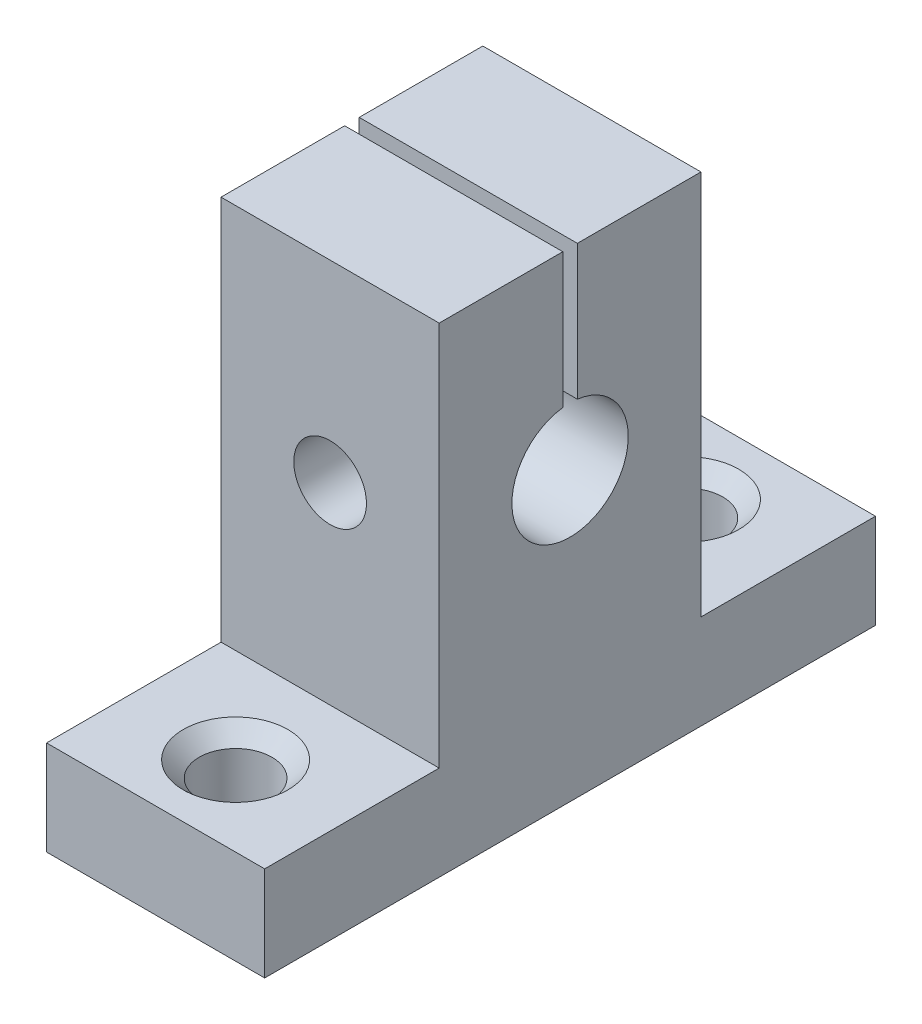
from build123d import *

# Parameters (mm, degrees)
PROFILEBOSS_EXTRUDE1_DEPTH         = 15
SKETCH2_R                          = 2.5
MOUNTHOLESCUT_EXTRUDE1_DEPTH       = 52.877258987
CHAMFER1_SIZE                      = 1.1
GROMMETHOLECUT_EXTRUDE2_REACH      = 49.053
GROMMETHOLECUT_EXTRUDE2_END_RADIUS = 4
SKETCH3_R                          = 2.5


with BuildPart() as part:
    # Sketch1 → ProfileBoss-Extrude1 (new body)
    with BuildSketch(Plane(origin=(0, 0, 0), x_dir=(0, 0, -1), z_dir=(1, 0, 0))):
        with BuildLine():
            Line((0, 0), (42, 0))
            Line((42, 0), (42, 6.5))
            Line((42, 6.5), (30, 6.5))
            Line((30, 6.5), (30, 33))
            Line((30, 33), (21.5, 33))
            Line((21.5, 33), (21.5, 23.718626967))
            ThreePointArc((21.5, 23.718626967), (21, 15.75), (20.5, 23.718626967))
            Line((20.5, 23.718626967), (20.5, 33))
            Line((20.5, 33), (12, 33))
            Line((12, 33), (12, 6.5))
            Line((12, 6.5), (0, 6.5))
            Line((0, 6.5), (0, 0))
        make_face()
    extrude(amount=PROFILEBOSS_EXTRUDE1_DEPTH)

    # Sketch2 → MountHolesCut-Extrude1 (cut, through all)
    with BuildSketch(Plane(origin=(0, 6.5, 0), x_dir=(1, 0, 0), z_dir=(0, 1, 0))):
        with Locations(Location((7.5, 5.5, 0), (0, 0, 270))):
            Circle(SKETCH2_R)
        with Locations(Location((7.5, 36.5, 0), (0, 0, 270))):
            Circle(SKETCH2_R)
    extrude(amount=-MOUNTHOLESCUT_EXTRUDE1_DEPTH, mode=Mode.SUBTRACT)

    # Chamfer1
    chamfer1_edges = [part.edges().sort_by_distance(p)[0] for p in [
        (7.5, 6.5, -8),
        (7.5, 6.5, -39),
    ]]
    chamfer(chamfer1_edges, length=CHAMFER1_SIZE)

    # GrommetHoleCut-Extrude2: up to this cylinder (the profile starts outside it)
    grommetholecut_extrude2_end = Plane(origin=(7.5, 19.75, -21), z_dir=(-1, 0, 0)) * Cylinder(GROMMETHOLECUT_EXTRUDE2_END_RADIUS, 107.106, mode=Mode.PRIVATE)
    # Sketch3 → GrommetHoleCut-Extrude2 (cut, up to the surface)
    with BuildSketch(Plane.XY.offset(-12), mode=Mode.PRIVATE) as grommetholecut_extrude2_sk1:
        with Locations((7.5, 19.75)):
            Circle(SKETCH3_R)
    grommetholecut_extrude2_tool1 = extrude(grommetholecut_extrude2_sk1.sketch, amount=-GROMMETHOLECUT_EXTRUDE2_REACH, mode=Mode.PRIVATE) - grommetholecut_extrude2_end
    add(grommetholecut_extrude2_tool1.solids().sort_by_distance((7.5, 19.75, -12))[0], mode=Mode.SUBTRACT)


solid = part.part
